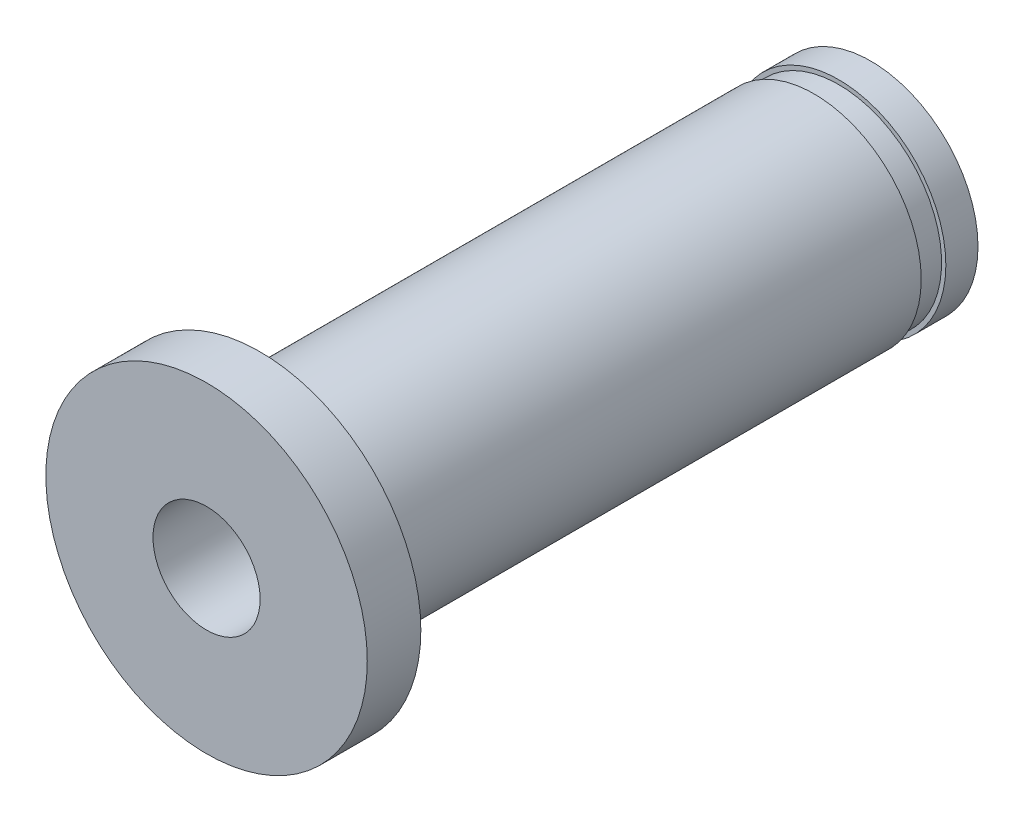
from build123d import *

# Parameters (mm, degrees)
SKIZZE1_R                       = 5
AUFSATZ_LINEAR_AUSTRAGEN1_DEPTH = 31
M6_GEWINDEBOHRUNG1_D            = 5
M6_GEWINDEBOHRUNG1_DEPTH        = 15
M6_GEWINDEBOHRUNG1_TIP          = 1.502151548
M6_GEWINDEBOHRUNG2_D            = 5
M6_GEWINDEBOHRUNG2_DEPTH        = 15
M6_GEWINDEBOHRUNG2_TIP          = 1.502151548
AUFSATZ_LINEAR_START            = -2.5
SKIZZE8_R                       = 7.5
SKIZZE8_R_2                     = 5
AUFSATZ_LINEAR_AUSTRAGEN3_DEPTH = 2.5
SKIZZE9_R                       = 5.404643903
SKIZZE9_R_2                     = 4.8
SCHNITT_LINEAR_AUSTRAGEN1_DEPTH = 1.15


with BuildPart() as part:
    # Skizze1 → Aufsatz-Linear austragen1 (new body)
    with BuildSketch(Plane.XY):
        Circle(SKIZZE1_R)
    extrude(amount=AUFSATZ_LINEAR_AUSTRAGEN1_DEPTH)

    # M6 Gewindebohrung1
    with Locations(Plane(origin=(0, 0, 0), x_dir=(-1, 0, 0), z_dir=(0, 0, -1))):
        with Locations((0, 0)):
            Hole(M6_GEWINDEBOHRUNG1_D / 2, depth=M6_GEWINDEBOHRUNG1_DEPTH)
            with Locations((0, 0, -(M6_GEWINDEBOHRUNG1_DEPTH + M6_GEWINDEBOHRUNG1_TIP / 2))):  # 118° drill point
                Cone(0, M6_GEWINDEBOHRUNG1_D / 2, M6_GEWINDEBOHRUNG1_TIP, mode=Mode.SUBTRACT)

    # M6 Gewindebohrung2
    with Locations(Plane.XY.offset(31)):
        with Locations((0, 0)):
            Hole(M6_GEWINDEBOHRUNG2_D / 2, depth=M6_GEWINDEBOHRUNG2_DEPTH)
            with Locations((0, 0, -(M6_GEWINDEBOHRUNG2_DEPTH + M6_GEWINDEBOHRUNG2_TIP / 2))):  # 118° drill point
                Cone(0, M6_GEWINDEBOHRUNG2_D / 2, M6_GEWINDEBOHRUNG2_TIP, mode=Mode.SUBTRACT)

    # Skizze8 → Aufsatz-Linear austragen3 (add)
    with BuildSketch(Plane.XY.offset(31).offset(AUFSATZ_LINEAR_START)):
        Circle(SKIZZE8_R)
        Circle(SKIZZE8_R_2, mode=Mode.SUBTRACT)
    extrude(amount=AUFSATZ_LINEAR_AUSTRAGEN3_DEPTH)

    # Skizze9 → Schnitt-Linear austragen1 (cut)
    with BuildSketch(Plane(origin=(0, 0, 1.5), x_dir=(-1, 0, 0), z_dir=(0, 0, -1))):
        Circle(SKIZZE9_R)
        Circle(SKIZZE9_R_2, mode=Mode.SUBTRACT)
    extrude(amount=-SCHNITT_LINEAR_AUSTRAGEN1_DEPTH, mode=Mode.SUBTRACT)


solid = part.part
